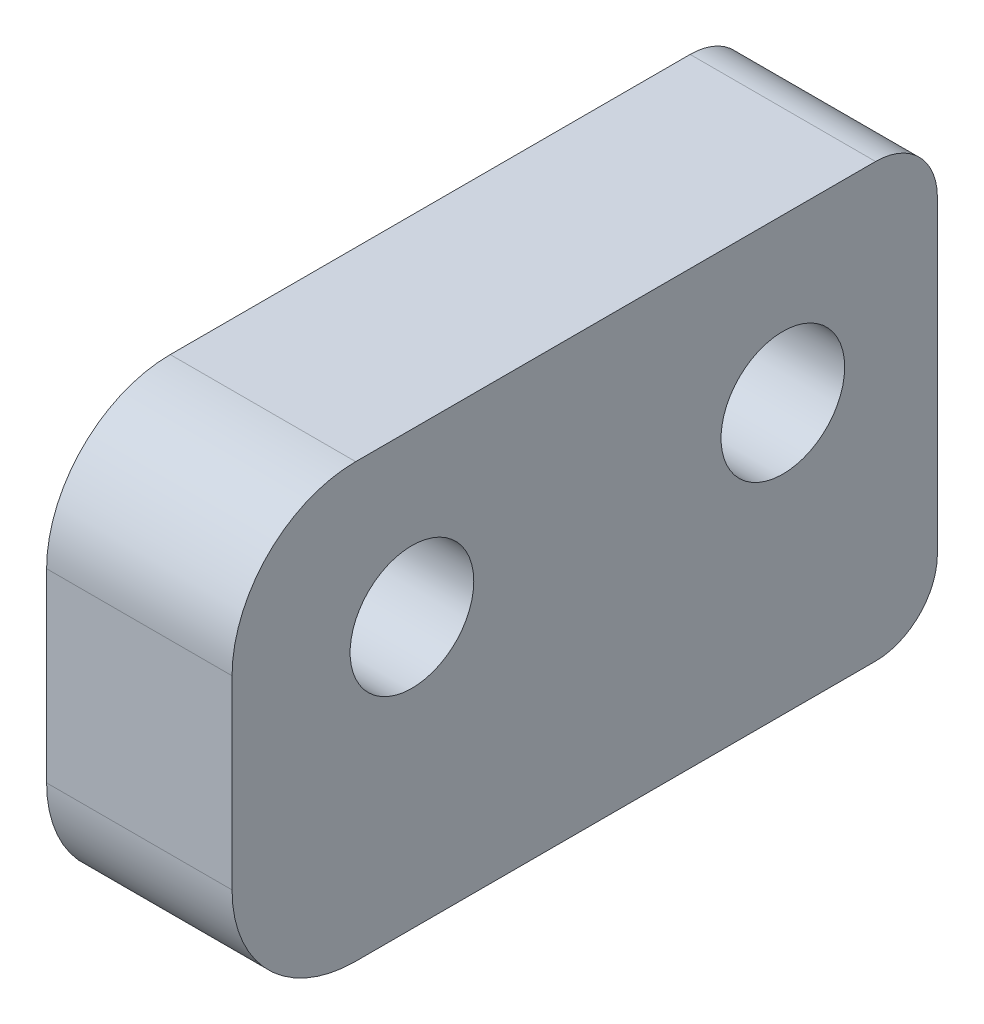
from build123d import *

# Parameters (mm, degrees)
SKETCH1_R           = 1
BOSS_EXTRUDE1_DEPTH = 3
FILLET1_R           = 2
FILLET2_R           = 1


with BuildPart() as part:
    # Sketch1 → Boss-Extrude1 (new body)
    with BuildSketch(Plane(origin=(0, 0, 0), x_dir=(0, 0, -1), z_dir=(1, 0, 0))):
        Polygon((-1.868695944, 2.63), (2.5, 2.63), (2.5, -4.37), (-8.91, -4.37), (-8.91, 2.63), align=None)
        Circle(SKETCH1_R, mode=Mode.SUBTRACT)
        with Locations((-6, 0)):
            Circle(SKETCH1_R, mode=Mode.SUBTRACT)
    extrude(amount=-BOSS_EXTRUDE1_DEPTH)

    # Fillet1
    fillet1_edges = [part.edges().sort_by_distance(p)[0] for p in [
        (-1.5, -4.37, 8.91),
        (-1.5, 2.63, 8.91),
    ]]
    fillet(fillet1_edges, radius=FILLET1_R)

    # Fillet2
    fillet2_edges = [part.edges().sort_by_distance(p)[0] for p in [
        (-1.5, 2.63, -2.5),
        (-1.5, -4.37, -2.5),
    ]]
    fillet(fillet2_edges, radius=FILLET2_R)


solid = part.part
